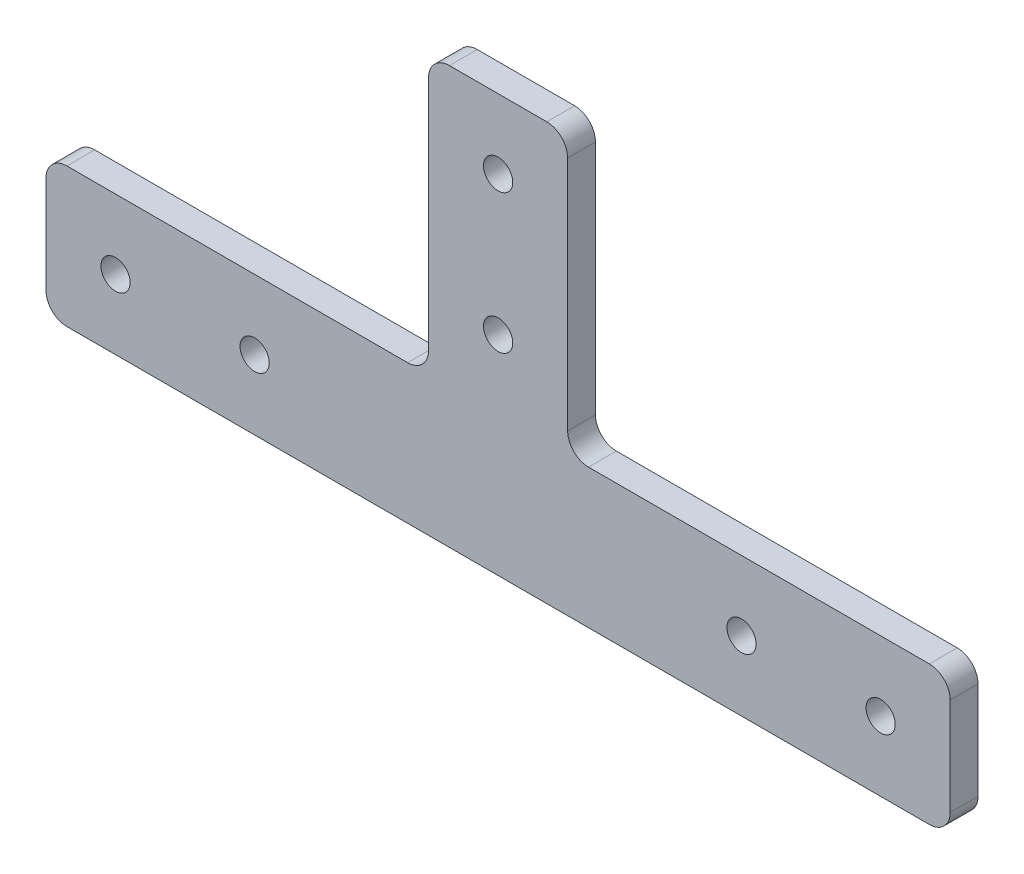
from build123d import *

# Parameters (mm, degrees)
SKETCH_1_W      = 130
SKETCH_1_H      = 20
SKETCH_1_R      = 2.1
SKETCH_1_W_2    = 20
SKETCH_1_H_2    = 40
EXTRUDE_1_DEPTH = 4
FILLET_1_R      = 3


with BuildPart() as part:
    # 草图1 → 凸台-拉伸1 (new body)
    # profile 1 of 2: a face of its own
    with BuildSketch(Plane.XY):
        Rectangle(SKETCH_1_W, SKETCH_1_H)
        with Locations((35, 0)):
            Circle(SKETCH_1_R, mode=Mode.SUBTRACT)
        with Locations((-35, 0)):
            Circle(SKETCH_1_R, mode=Mode.SUBTRACT)
        with Locations((-55, 0)):
            Circle(SKETCH_1_R, mode=Mode.SUBTRACT)
        with Locations((55, 0)):
            Circle(SKETCH_1_R, mode=Mode.SUBTRACT)
    # profile 2 of 2: a face of its own
    with BuildSketch(Plane.XY):
        with Locations((0, 30)):
            Rectangle(SKETCH_1_W_2, SKETCH_1_H_2)
        with Locations((0, 20)):
            Circle(SKETCH_1_R, mode=Mode.SUBTRACT)
        with Locations((0, 40)):
            Circle(SKETCH_1_R, mode=Mode.SUBTRACT)
    extrude(amount=EXTRUDE_1_DEPTH)

    # 圆角1
    fillet_1_edges = [part.edges().sort_by_distance(p)[0] for p in [
        (65, -10, 2),
        (-65, -10, 2),
        (-65, 10, 2),
        (-10, 10, 2),
        (-10, 50, 2),
        (10, 50, 2),
        (10, 10, 2),
        (65, 10, 2),
    ]]
    fillet(fillet_1_edges, radius=FILLET_1_R)


solid = part.part
